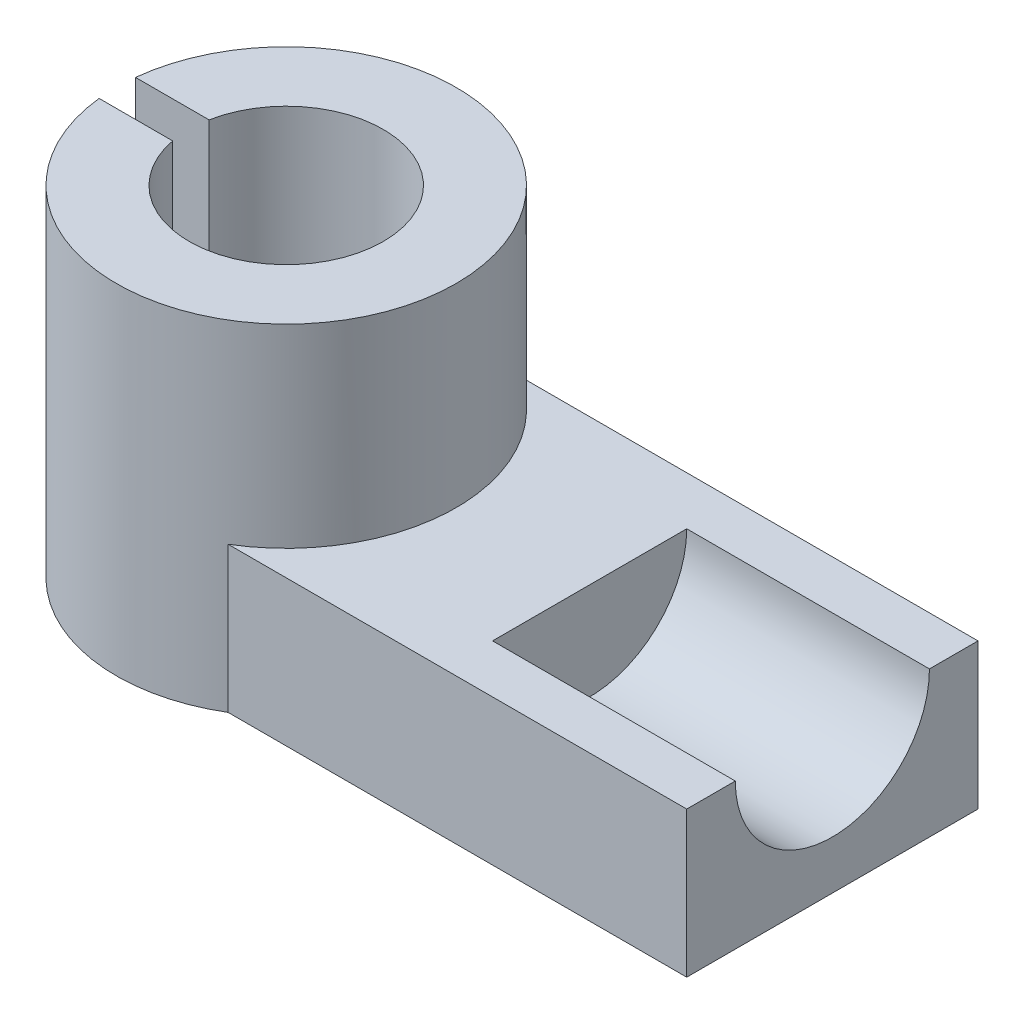
from build123d import *
from build123d.topology import SkipClean

# Parameters (mm, degrees)
BOSS_EXTRUDE2_DEPTH = 60.96
SKETCH2_R           = 71.12
BOSS_EXTRUDE3_DEPTH = 81.28
CUT_EXTRUDE1_DEPTH  = 101.6
CUT_EXTRUDE2_START  = -142.24
CUT_EXTRUDE2_DEPTH  = 142.24


with BuildPart() as part:
    # Sketch1 → Boss-Extrude2 (new body)
    with BuildSketch(Plane(origin=(0, 0, 0), x_dir=(1, 0, 0), z_dir=(0, 1, 0))):
        with BuildLine():
            Line((228.6, 60.96), (228.6, -60.96))
            Line((228.6, -60.96), (36.632400959, -60.96))
            ThreePointArc((36.632400959, -60.96), (-71.12, 0), (36.632400959, 60.96))
            Line((36.632400959, 60.96), (228.6, 60.96))
        make_face()
    extrude(amount=BOSS_EXTRUDE2_DEPTH)

    # Sketch2 → Boss-Extrude3 (add)
    with SkipClean():  # the faces are left unmerged after this step: merging them gives an invalid solid
        with BuildSketch(Plane(origin=(0, 60.96, 0), x_dir=(1, 0, 0), z_dir=(0, 1, 0))):
            with Locations(Location((0, 0, 0), (0, 0, 58.997280866))):
                Circle(SKETCH2_R)
        extrude(amount=BOSS_EXTRUDE3_DEPTH)

    # Sketch3 → Cut-Extrude1 (cut)
    with SkipClean():  # the faces are left unmerged after this step: merging them gives an invalid solid
        with BuildSketch(Plane(origin=(228.6, 0, 0), x_dir=(0, 0, -1), z_dir=(1, 0, 0))):
            with BuildLine():
                Line((40.64, 60.96), (-40.64, 60.96))
                ThreePointArc((-40.64, 60.96), (0, 20.32), (40.64, 60.96))
            make_face()
        extrude(amount=-CUT_EXTRUDE1_DEPTH, mode=Mode.SUBTRACT)

    # Sketch4 → Cut-Extrude2 (cut)
    with SkipClean():  # the faces are left unmerged after this step: merging them gives an invalid solid
        with BuildSketch(Plane(origin=(0, 142.24, 0), x_dir=(1, 0, 0), z_dir=(0, 1, 0)).offset(CUT_EXTRUDE2_START)):
            with BuildLine():
                Line((-39.91923346, 7.62), (-70.710607408, 7.62))
                ThreePointArc((-70.710607408, 7.62), (-71.12, 0), (-70.710607408, -7.62))
                Line((-70.710607408, -7.62), (-39.91923346, -7.62))
                ThreePointArc((-39.91923346, -7.62), (40.64, 0), (-39.91923346, 7.62))
            make_face()
        extrude(amount=CUT_EXTRUDE2_DEPTH, mode=Mode.SUBTRACT)


solid = part.part
